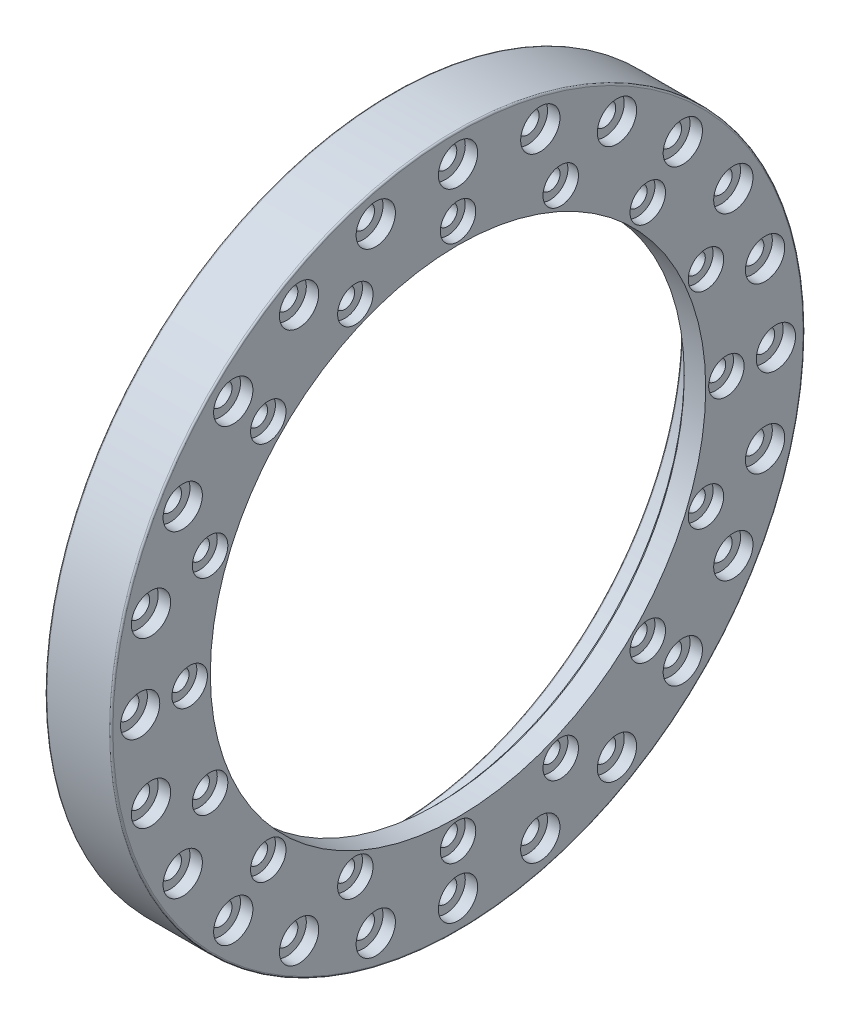
from build123d import *

# Parameters (mm, degrees)
CBORE_FOR_M12_HEX_HEAD_BOLT3_D           = 13.5
CBORE_FOR_M12_HEX_HEAD_BOLT3_CBORE_D     = 23.785
CBORE_FOR_M12_HEX_HEAD_BOLT3_CBORE_DEPTH = 7.5
CIRPATTERN1_COUNT                        = 24
FILLET1_R                                = 1
CHAMFER1_SIZE                            = 2
CBORE_FOR_M10_HEX_HEAD_BOLT1_D           = 12
CBORE_FOR_M10_HEX_HEAD_BOLT1_CBORE_D     = 21.475
CBORE_FOR_M10_HEX_HEAD_BOLT1_CBORE_DEPTH = 6.4
CIRPATTERN2_COUNT                        = 16


with BuildPart() as part:
    # Sketch1 → Revolve1 (revolve)
    with BuildSketch(Plane.XY):
        Polygon((-20, 210), (20, 210), (20, 150), (5, 150), (5, 175), (-20, 175), align=None)
    revolve(axis=Axis((0, 0, 0), (-1, 0, 0)))

    # CBORE for M12 Hex Head Bolt3 (through all)
    with Locations(Plane(origin=(20, 192.5, 0), x_dir=(0, 0, 1), z_dir=(1, 0, 0))):
        with Locations((0, 0)):
            cbore_for_m12_hex_head_bolt3 = CounterBoreHole(CBORE_FOR_M12_HEX_HEAD_BOLT3_D / 2, CBORE_FOR_M12_HEX_HEAD_BOLT3_CBORE_D / 2, CBORE_FOR_M12_HEX_HEAD_BOLT3_CBORE_DEPTH)

    # CirPattern1: CBORE for M12 Hex Head Bolt3 ×24 about axis
    cirpattern1_axis = Axis((-20, 0, 0), (1, 0, 0))
    for i in range(1, CIRPATTERN1_COUNT):
        add(cbore_for_m12_hex_head_bolt3.rotate(cirpattern1_axis, i * 360 / CIRPATTERN1_COUNT), mode=Mode.SUBTRACT)

    # Fillet1
    fillet1_edges = [part.edges().sort_by_distance(p)[0] for p in [
        (-20, -175, 0),
        (20, -210, 0),
        (-20, -210, 0),
    ]]
    fillet(fillet1_edges, radius=FILLET1_R)

    # Chamfer1
    chamfer1_edges = [part.edges().sort_by_distance(p)[0] for p in [
        (5, -150, 0),
    ]]
    chamfer(chamfer1_edges, length=CHAMFER1_SIZE)

    # CBORE for M10 Hex Head Bolt1 (through all)
    with Locations(Plane(origin=(20, 162.5, 0), x_dir=(0, 0, 1), z_dir=(1, 0, 0))):
        with Locations((0, 0)):
            cbore_for_m10_hex_head_bolt1 = CounterBoreHole(CBORE_FOR_M10_HEX_HEAD_BOLT1_D / 2, CBORE_FOR_M10_HEX_HEAD_BOLT1_CBORE_D / 2, CBORE_FOR_M10_HEX_HEAD_BOLT1_CBORE_DEPTH)

    # CirPattern2: CBORE for M10 Hex Head Bolt1 ×16 about axis
    cirpattern2_axis = Axis((-20, 0, 0), (1, 0, 0))
    for i in range(1, CIRPATTERN2_COUNT):
        add(cbore_for_m10_hex_head_bolt1.rotate(cirpattern2_axis, i * 360 / CIRPATTERN2_COUNT), mode=Mode.SUBTRACT)


solid = part.part
